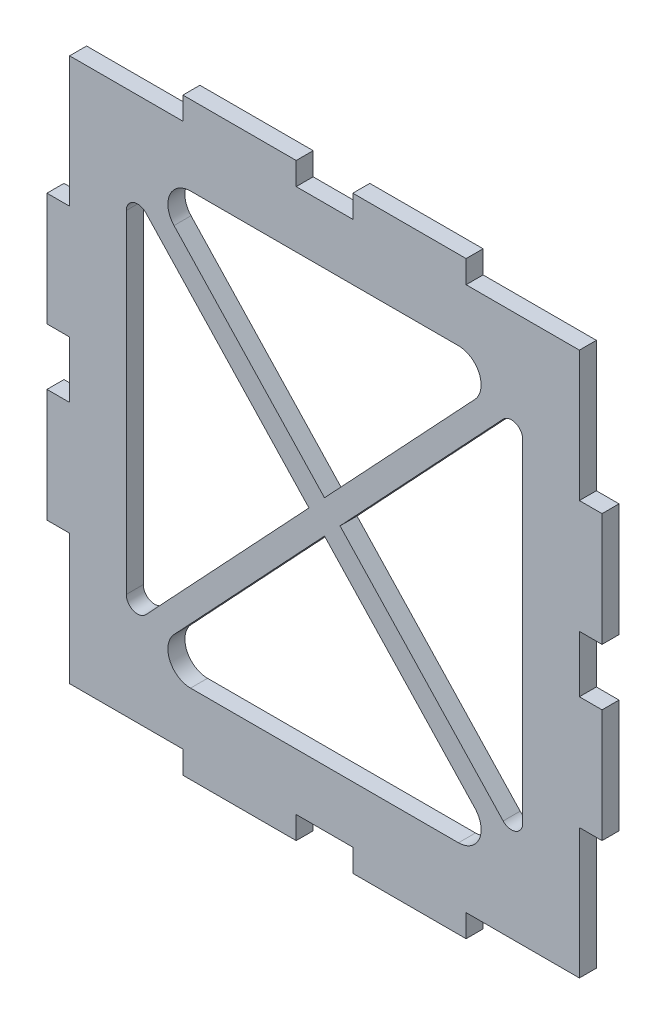
from build123d import *

# Parameters (mm, degrees)
EXTRUDE_1_DEPTH = 1.5


with BuildPart() as part:
    # 草图1 → 凸台-拉伸1 (new body)
    with BuildSketch(Plane.XY):
        Polygon((2019.783981078, 1091.373902802), (2017.283981078, 1091.373902802), (2017.283981078, 1092.123902802), (2017.283981078, 1092.873902802), (2017.283981078, 1093.373902802), (2007.283981078, 1093.373902802), (2007.283981078, 1091.373902802), (1997.283981078, 1091.373902802), (1997.283981078, 1079.873902802), (1995.283981078, 1079.873902802), (1995.283981078, 1069.873902802), (1997.283981078, 1069.873902802), (1997.283981078, 1067.373902802), (1997.283981078, 1064.873902802), (1995.283981078, 1064.873902802), (1995.283981078, 1054.873902802), (1997.283981078, 1054.873902802), (1997.283981078, 1043.373902802), (2007.283981078, 1043.373902802), (2007.283981078, 1041.373902802), (2017.283981078, 1041.373902802), (2017.283981078, 1041.873902802), (2017.283981078, 1042.623902802), (2017.283981078, 1043.373902802), (2019.783981078, 1043.373902802), (2022.283981078, 1043.373902802), (2022.283981078, 1041.373902802), (2032.283981078, 1041.373902802), (2032.283981078, 1043.373902802), (2042.283981078, 1043.373902802), (2042.283981078, 1054.873902802), (2044.283981078, 1054.873902802), (2044.283981078, 1064.873902802), (2042.283981078, 1064.873902802), (2042.283981078, 1069.873902802), (2044.283981078, 1069.873902802), (2044.283981078, 1079.873902802), (2042.283981078, 1079.873902802), (2042.283981078, 1091.373902802), (2032.283981078, 1091.373902802), (2032.283981078, 1093.373902802), (2022.283981078, 1093.373902802), (2022.283981078, 1091.373902802), align=None)
        with BuildLine():
            ThreePointArc((2002.283981078, 1082.049678273), (2002.916242787, 1082.979607598), (2004.013518177, 1082.733619515))
            Line((2004.013518177, 1082.733619515), (2018.413275311, 1067.373883329))
            Line((2018.413275311, 1067.373883329), (2003.990695742, 1051.989772853))
            ThreePointArc((2003.990695742, 1051.989772853), (2002.901194073, 1051.77400368), (2002.284383627, 1052.697645979))
            Line((2002.284383627, 1052.697645979), (2002.283981078, 1082.049678273))
        make_face(mode=Mode.SUBTRACT)
        with BuildLine():
            Line((2006.500027427, 1051.741419113), (2019.783962961, 1065.911816955))
            Line((2019.783962961, 1065.911816955), (2033.112750227, 1051.694448274))
            ThreePointArc((2033.112750227, 1051.694448274), (2033.432254782, 1049.549898759), (2031.610267078, 1048.374510912))
            Line((2031.610267078, 1048.374510912), (2007.959194424, 1048.373577103))
            ThreePointArc((2007.959194424, 1048.373577103), (2006.123982355, 1049.578468297), (2006.500027427, 1051.741419113))
        make_face(mode=Mode.SUBTRACT)
        with BuildLine():
            ThreePointArc((2035.554813272, 1082.733239324), (2036.639700026, 1082.984007677), (2037.283981078, 1082.075841414))
            Line((2037.283981078, 1082.075841414), (2037.283981078, 1052.660116534))
            ThreePointArc((2037.283981078, 1052.660116534), (2036.634357537, 1051.762085182), (2035.555234557, 1052.014997514))
            Line((2035.555234557, 1052.014997514), (2021.154687715, 1067.373920926))
            Line((2021.154687715, 1067.373920926), (2035.554813272, 1082.733239324))
        make_face(mode=Mode.SUBTRACT)
        with BuildLine():
            Line((2019.783998208, 1068.835990185), (2006.499598649, 1083.00602077))
            ThreePointArc((2006.499598649, 1083.00602077), (2006.12349425, 1085.16896127), (2007.958673269, 1086.373902802))
            Line((2007.958673269, 1086.373902802), (2031.609745939, 1086.373617718))
            ThreePointArc((2031.609745939, 1086.373617718), (2033.436053968, 1085.188739103), (2033.098431951, 1083.038076479))
            Line((2033.098431951, 1083.038076479), (2019.783998208, 1068.835990185))
        make_face(mode=Mode.SUBTRACT)
    extrude(amount=EXTRUDE_1_DEPTH)


solid = part.part
